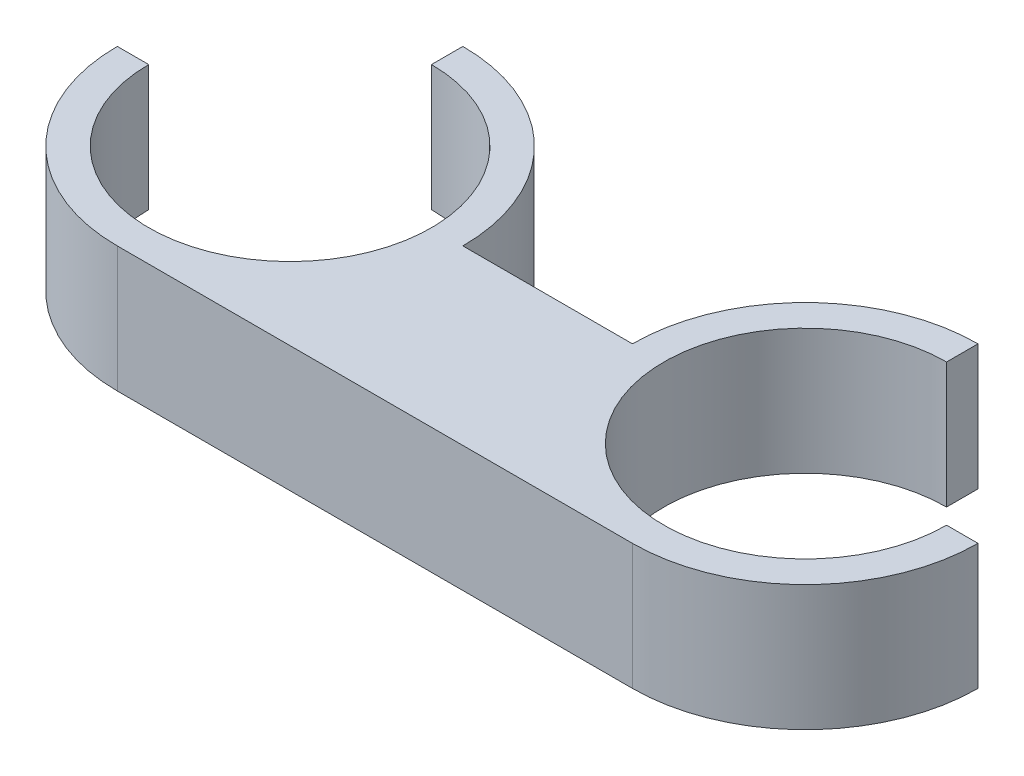
from build123d import *

# Parameters (mm, degrees)
BOSS_EXTRUDE1_DEPTH = 8


with BuildPart() as part:
    # Sketch1 → Boss-Extrude1 (new body)
    with BuildSketch(Plane(origin=(0, 0, 0), x_dir=(1, 0, 0), z_dir=(0, 1, 0))):
        with BuildLine():
            ThreePointArc((-43.795204124, 0), (-25.017029531, -7.778174593), (-32.795204124, 11))
            Line((-32.795204124, 11), (-32.795204124, 9))
            ThreePointArc((-32.795204124, 9), (-26.431243094, -6.363961031), (-41.795204124, 0))
            Line((-41.795204124, 0), (-43.795204124, 0))
        make_face()
        with BuildLine():
            Line((-16.397602062, -11), (-16.397602062, 0))
            Line((-16.397602062, 0), (-21.795204124, 0))
            ThreePointArc((-21.795204124, 0), (-25.017029531, -7.778174593), (-32.795204124, -11))
            Line((-32.795204124, -11), (-16.397602062, -11))
        make_face()
        with BuildLine():
            ThreePointArc((0, -11), (-7.778174593, -7.778174593), (-11, 0))
            Line((-11, 0), (-16.397602062, 0))
            Line((-16.397602062, 0), (-16.397602062, -11))
            Line((-16.397602062, -11), (0, -11))
        make_face()
        with BuildLine():
            ThreePointArc((11, 0), (-7.778174593, -7.778174593), (0, 11))
            Line((0, 11), (0, 9))
            ThreePointArc((0, 9), (-6.363961031, -6.363961031), (9, 0))
            Line((9, 0), (11, 0))
        make_face()
    extrude(amount=BOSS_EXTRUDE1_DEPTH)


solid = part.part
